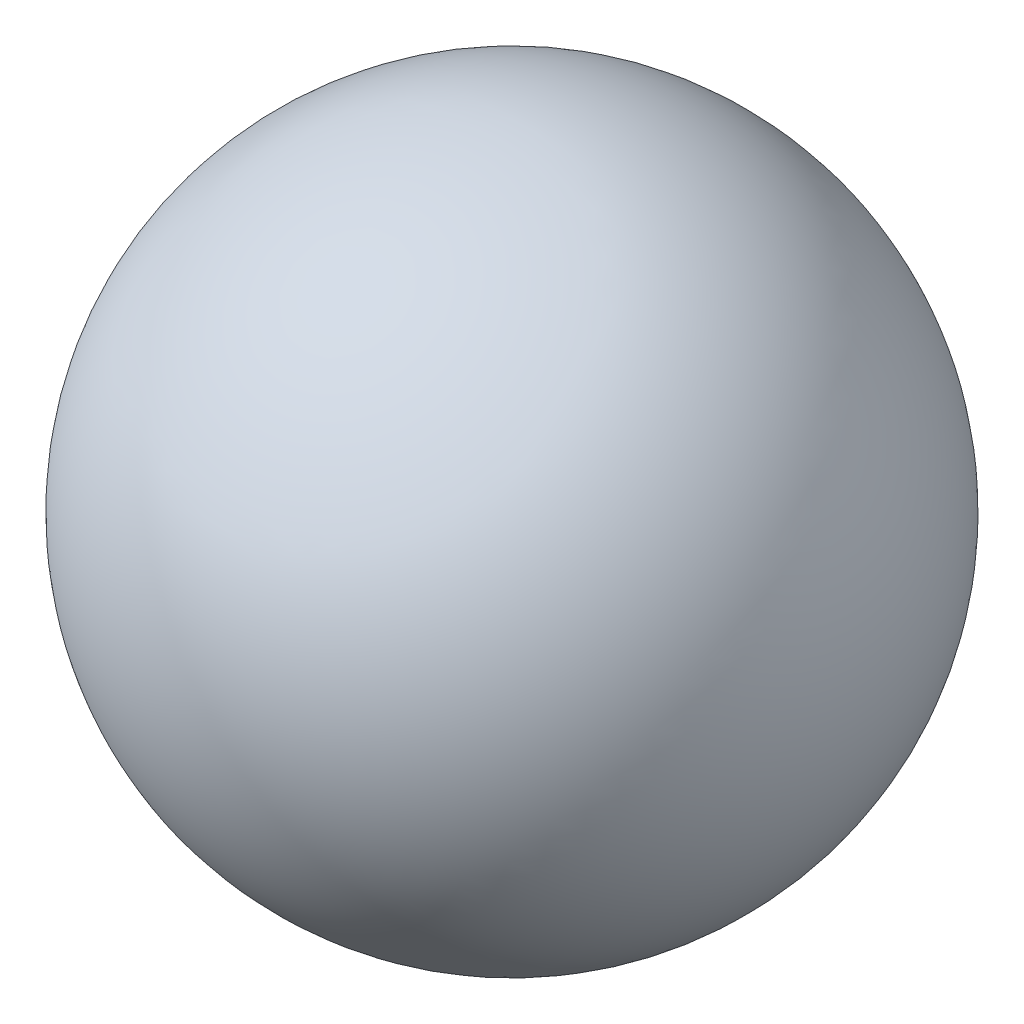
from build123d import *


with BuildPart() as part:
    # Sketch1 → Revolve1 (revolve)
    with BuildSketch(Plane(origin=(0, 0, 0), x_dir=(1, 0, 0), z_dir=(0, 1, 0))):
        with BuildLine():
            Line((0, 11.43), (0, -11.43))
            ThreePointArc((0, -11.43), (11.43, 0), (0, 11.43))
        make_face()
    revolve(axis=Axis((0, 0, -11.43), (0, 0, 1)))


solid = part.part
